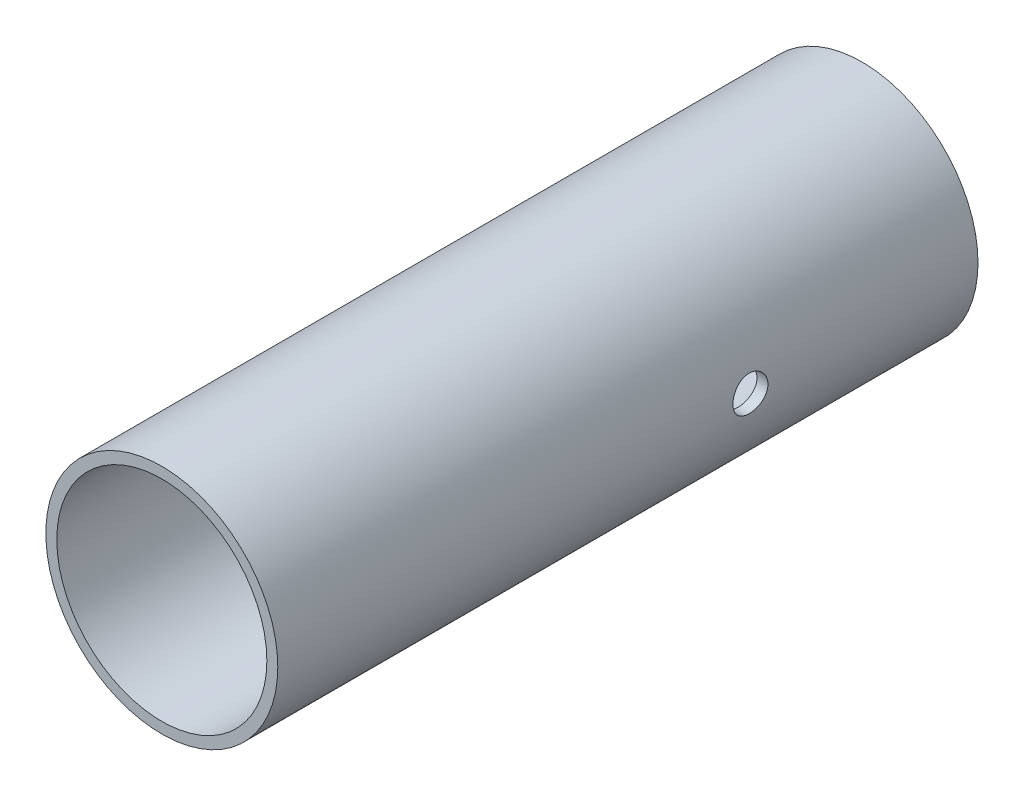
from build123d import *

# Parameters (mm, degrees)
SKETCH1_R               = 84.1375
SKETCH1_R_2             = 76.2
EXTRUDE1_DEPTH          = 508
CUT_EXTRUDE1_DEPTH      = 522.74920969
CUT_EXTRUDE1_DEPTH_BACK = 522.74920969
SKETCH2_R               = 12.7


with BuildPart() as part:
    # Sketch1 → Extrude1 (new body)
    with BuildSketch(Plane.XY):
        Circle(SKETCH1_R)
        Circle(SKETCH1_R_2, mode=Mode.SUBTRACT)
    extrude(amount=EXTRUDE1_DEPTH)

    # Sketch2 → Cut-Extrude1 (cut, two sides: drawn at the far end of the back side and taken through both)
    with BuildSketch(Plane(origin=(0, 0, 0), x_dir=(0, 0, -1), z_dir=(1, 0, 0)).offset(-CUT_EXTRUDE1_DEPTH_BACK)):
        with Locations((-165.1, 0)):
            Circle(SKETCH2_R)
    extrude(amount=CUT_EXTRUDE1_DEPTH + CUT_EXTRUDE1_DEPTH_BACK, mode=Mode.SUBTRACT)


solid = part.part
